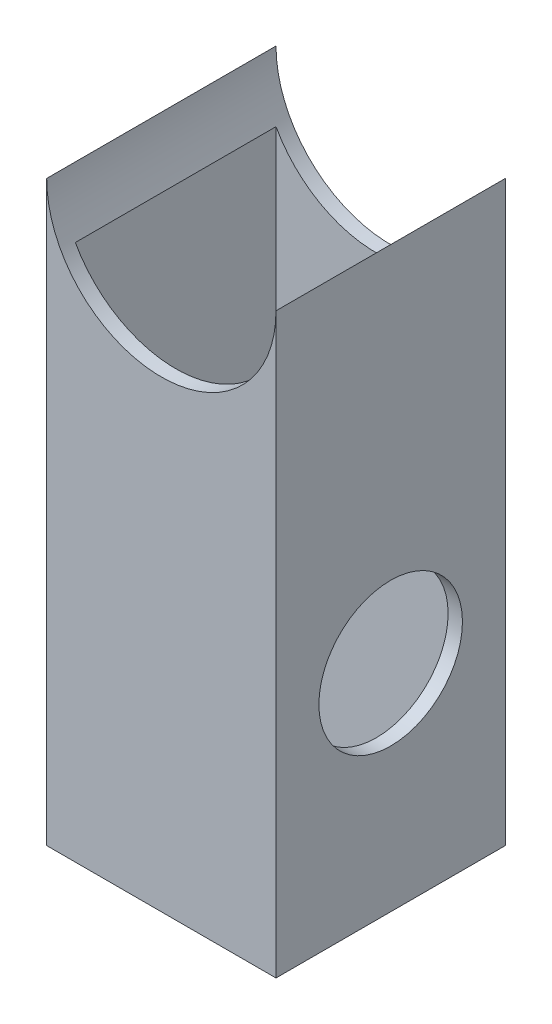
from build123d import *

# Parameters (mm, degrees)
SKETCH1_W           = 25.4
SKETCH1_H           = 25.4
SKETCH1_W_2         = 22.225
SKETCH1_H_2         = 22.225
BOSS_EXTRUDE1_DEPTH = 63.99895
SKETCH2_R           = 12.7
CUT_EXTRUDE1_DEPTH  = 71.016538054
SKETCH3_R           = 7.9502
CUT_EXTRUDE2_DEPTH  = 71.016538223


with BuildPart() as part:
    # Sketch1 → Boss-Extrude1 (new body)
    with BuildSketch(Plane(origin=(0, 0, 0), x_dir=(1, 0, 0), z_dir=(0, 1, 0))):
        Rectangle(SKETCH1_W, SKETCH1_H)
        Rectangle(SKETCH1_W_2, SKETCH1_H_2, mode=Mode.SUBTRACT)
    extrude(amount=BOSS_EXTRUDE1_DEPTH)

    # Sketch2 → Cut-Extrude1 (cut, through all)
    with BuildSketch(Plane.XY.offset(12.7)):
        with Locations((0, 63.998950185)):
            Circle(SKETCH2_R)
    extrude(amount=-CUT_EXTRUDE1_DEPTH, mode=Mode.SUBTRACT)

    # Sketch3 → Cut-Extrude2 (cut, through all)
    with BuildSketch(Plane(origin=(12.7, 0, 0), x_dir=(0, 0, -1), z_dir=(1, 0, 0))):
        with Locations((0, 23.8506)):
            Circle(SKETCH3_R)
    extrude(amount=-CUT_EXTRUDE2_DEPTH, mode=Mode.SUBTRACT)


solid = part.part
